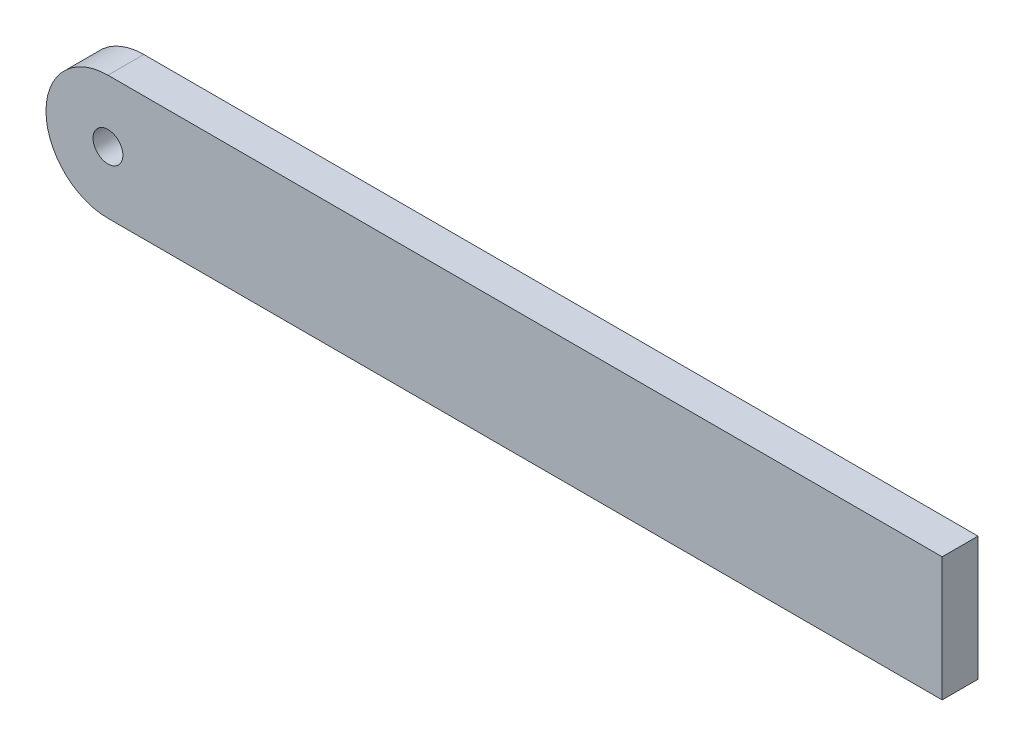
from build123d import *

# Parameters (mm, degrees)
SKETCH1_R           = 2.5
BOSS_EXTRUDE1_DEPTH = 6


with BuildPart() as part:
    # Sketch1 → Boss-Extrude1 (new body)
    with BuildSketch(Plane.XY):
        with BuildLine():
            Line((-64.63, 10.375), (75, 10.375))
            Line((75, 10.375), (75, -10.375))
            Line((75, -10.375), (-64.63, -10.375))
            ThreePointArc((-64.63, -10.375), (-71.962697321, -7.337697321), (-75, -0.005))
            Line((-75, -0.005), (-75, 0.005))
            ThreePointArc((-75, 0.005), (-71.962697321, 7.337697321), (-64.63, 10.375))
        make_face()
        with Locations((-64.63, 0.005)):
            Circle(SKETCH1_R, mode=Mode.SUBTRACT)
    extrude(amount=BOSS_EXTRUDE1_DEPTH)


solid = part.part
